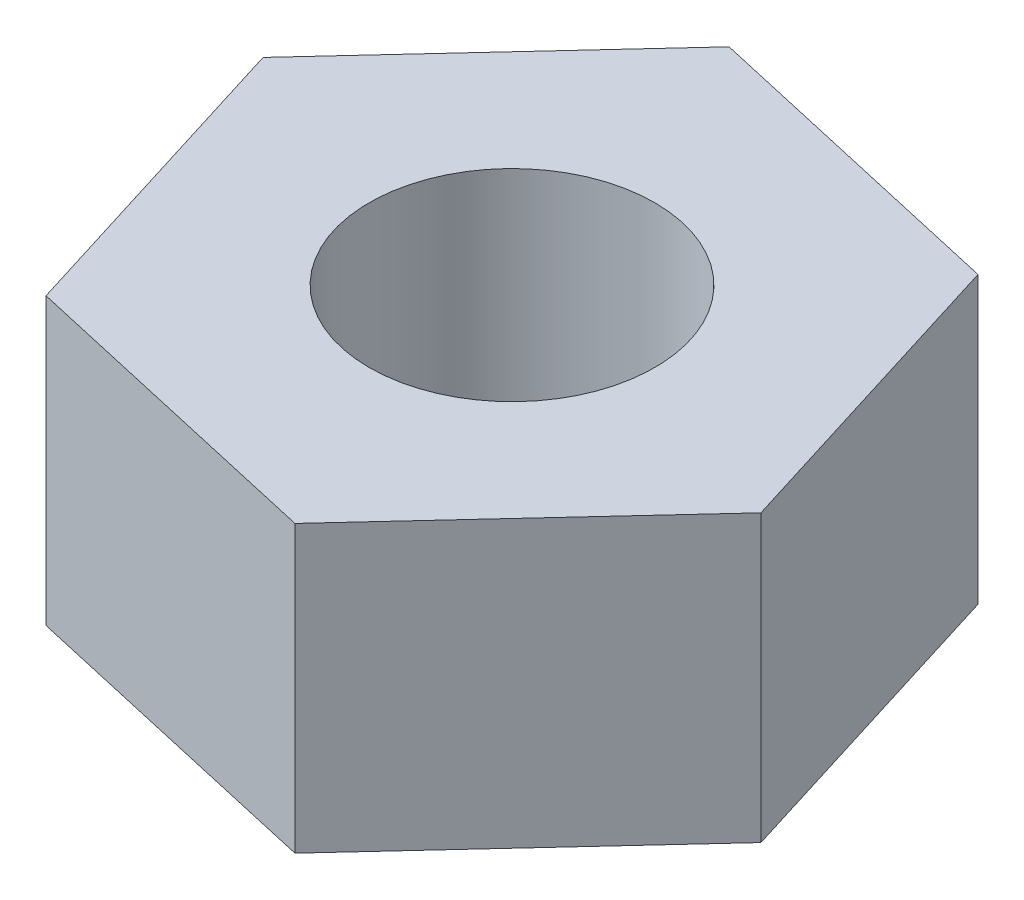
from build123d import *

# Parameters (mm, degrees)
ESQUISSE1_R        = 1.5
BOSS_EXTRU_1_DEPTH = 3


with BuildPart() as part:
    # Esquisse1 → Boss.-Extru.1 (new body)
    with BuildSketch(Plane.XZ.offset(3)):
        Polygon((2.350913118, -2.544249892), (3.378841599, 0.763825536), (1.027928481, 3.308075428), (-2.350913118, 2.544249892), (-3.378841599, -0.763825536), (-1.027928481, -3.308075428), align=None)
        with Locations(Location((0, 0, 0), (0, 0, 90))):
            Circle(ESQUISSE1_R, mode=Mode.SUBTRACT)
    extrude(amount=-BOSS_EXTRU_1_DEPTH)


solid = part.part
